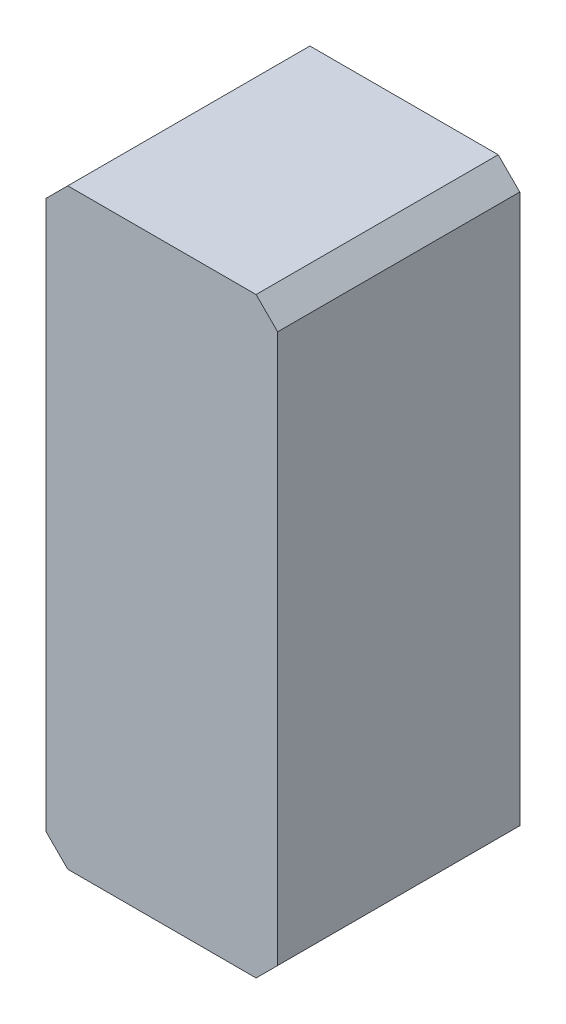
from build123d import *

# Parameters (mm, degrees)
F_6S3000MAH_DEPTH = 45


with BuildPart() as part:
    # 草图1 → 6S3000mAh临时外形 (new body)
    with BuildSketch(Plane.XY):
        Polygon((-17.5, -55), (17.5, -55), (21.5, -51), (21.5, 51), (17.5, 55), (-17.5, 55), (-21.5, 51), (-21.5, -51), align=None)
    extrude(amount=F_6S3000MAH_DEPTH)


solid = part.part
